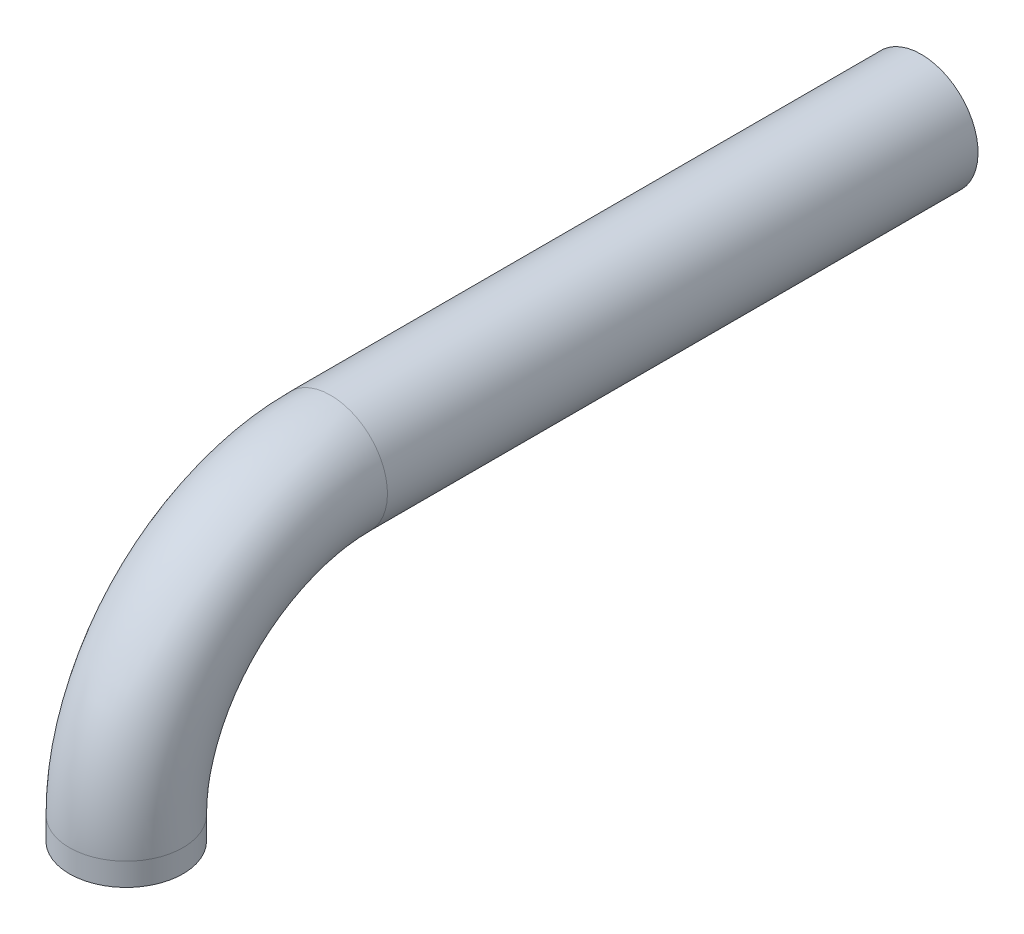
from build123d import *

# Parameters (mm, degrees)
SKIZZE2_R   = 1.25
SKIZZE2_R_2 = 1


with BuildPart() as part:
    # Austragung1: sweep along a path in Skizze1
    with BuildLine(Plane(origin=(0, 0, 0), x_dir=(0, 0, -1), z_dir=(1, 0, 0))) as austragung1_path:
        Line((0, 0), (0, 0.5))
        ThreePointArc((0, 0.5), (1.318019485, 3.681980515), (4.5, 5))
        Line((4.5, 5), (17.5, 5))
    # Skizze2 → Austragung1 (sweep)
    with BuildSketch(Plane(origin=(0, 0, 0), x_dir=(1, 0, 0), z_dir=(0, 1, 0))):
        Circle(SKIZZE2_R)
        Circle(SKIZZE2_R_2, mode=Mode.SUBTRACT)
    sweep(path=austragung1_path.line)


solid = part.part
